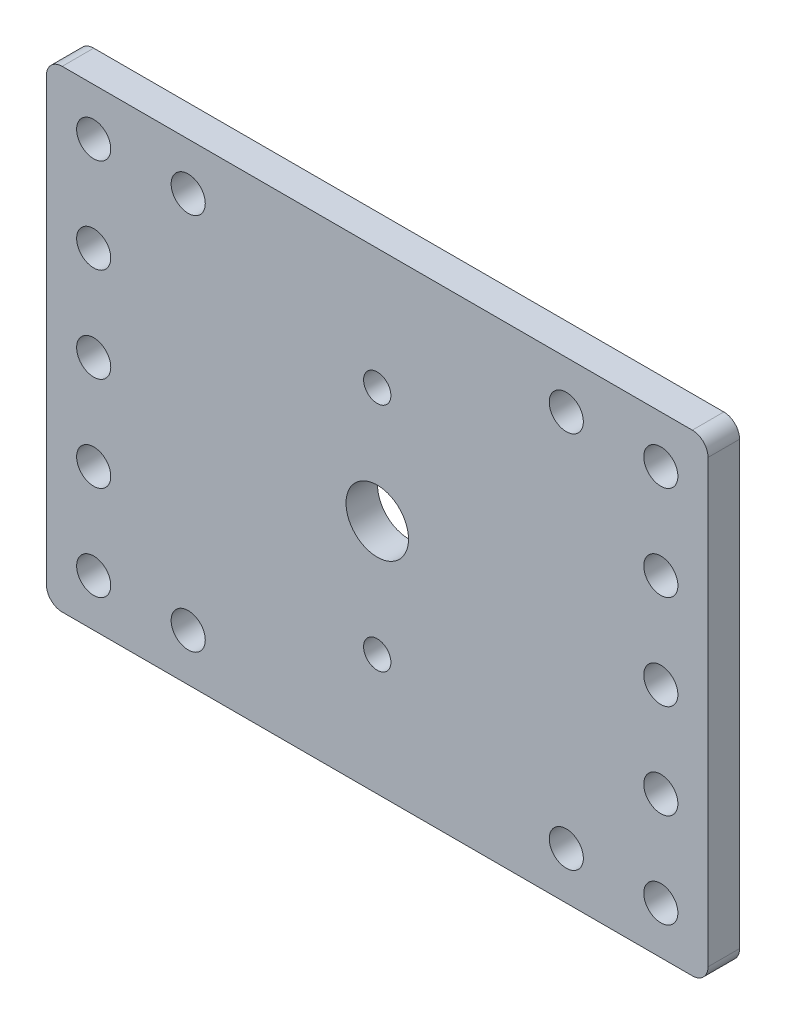
from build123d import *

# Parameters (mm, degrees)
MODEL_R                 = 1.625
MODEL_R_2               = 2.975
MODEL_R_3               = 1.3
SALIENTE_EXTRUIR1_DEPTH = 3


with BuildPart() as part:
    # Model → Saliente-Extruir1 (new body)
    with BuildSketch(Plane.XY):
        with BuildLine():
            Line((194.757320591, 257.267727456), (254.757320591, 257.267727456))
            ThreePointArc((254.757320591, 257.267727456), (255.817980763, 256.828387628), (256.257320591, 255.767727456))
            Line((256.257320591, 255.767727456), (256.257320591, 213.767727456))
            ThreePointArc((256.257320591, 213.767727456), (255.817980763, 212.707067284), (254.757320591, 212.267727456))
            Line((254.757320591, 212.267727456), (194.757320591, 212.267727456))
            ThreePointArc((194.757320591, 212.267727456), (193.696660419, 212.707067284), (193.257320591, 213.767727456))
            Line((193.257320591, 213.767727456), (193.257320591, 255.767727456))
            ThreePointArc((193.257320591, 255.767727456), (193.696660419, 256.828387628), (194.757320591, 257.267727456))
        make_face()
        with Locations((206.757320591, 252.767727456)):
            Circle(MODEL_R, mode=Mode.SUBTRACT)
        with Locations((206.757320591, 216.767727456)):
            Circle(MODEL_R, mode=Mode.SUBTRACT)
        with Locations((224.757320591, 234.767727456)):
            Circle(MODEL_R_2, mode=Mode.SUBTRACT)
        with Locations((242.757320591, 252.767727456)):
            Circle(MODEL_R, mode=Mode.SUBTRACT)
        with Locations((242.757320591, 216.767727456)):
            Circle(MODEL_R, mode=Mode.SUBTRACT)
        with Locations((224.757320591, 223.767727456)):
            Circle(MODEL_R_3, mode=Mode.SUBTRACT)
        with Locations((224.757320591, 245.767727456)):
            Circle(MODEL_R_3, mode=Mode.SUBTRACT)
        with Locations((197.757320591, 252.767727456)):
            Circle(MODEL_R, mode=Mode.SUBTRACT)
        with Locations((251.757320591, 252.767727456)):
            Circle(MODEL_R, mode=Mode.SUBTRACT)
        with Locations((251.757320591, 216.767727456)):
            Circle(MODEL_R, mode=Mode.SUBTRACT)
        with Locations((197.757320591, 216.767727456)):
            Circle(MODEL_R, mode=Mode.SUBTRACT)
        with Locations((197.757320591, 234.767727456)):
            Circle(MODEL_R, mode=Mode.SUBTRACT)
        with Locations((251.757320591, 234.767727456)):
            Circle(MODEL_R, mode=Mode.SUBTRACT)
        with Locations((197.757320591, 243.767727456)):
            Circle(MODEL_R, mode=Mode.SUBTRACT)
        with Locations((197.757320591, 225.767727456)):
            Circle(MODEL_R, mode=Mode.SUBTRACT)
        with Locations((251.757320591, 243.767727456)):
            Circle(MODEL_R, mode=Mode.SUBTRACT)
        with Locations((251.757320591, 225.767727456)):
            Circle(MODEL_R, mode=Mode.SUBTRACT)
    extrude(amount=SALIENTE_EXTRUIR1_DEPTH)


solid = part.part
